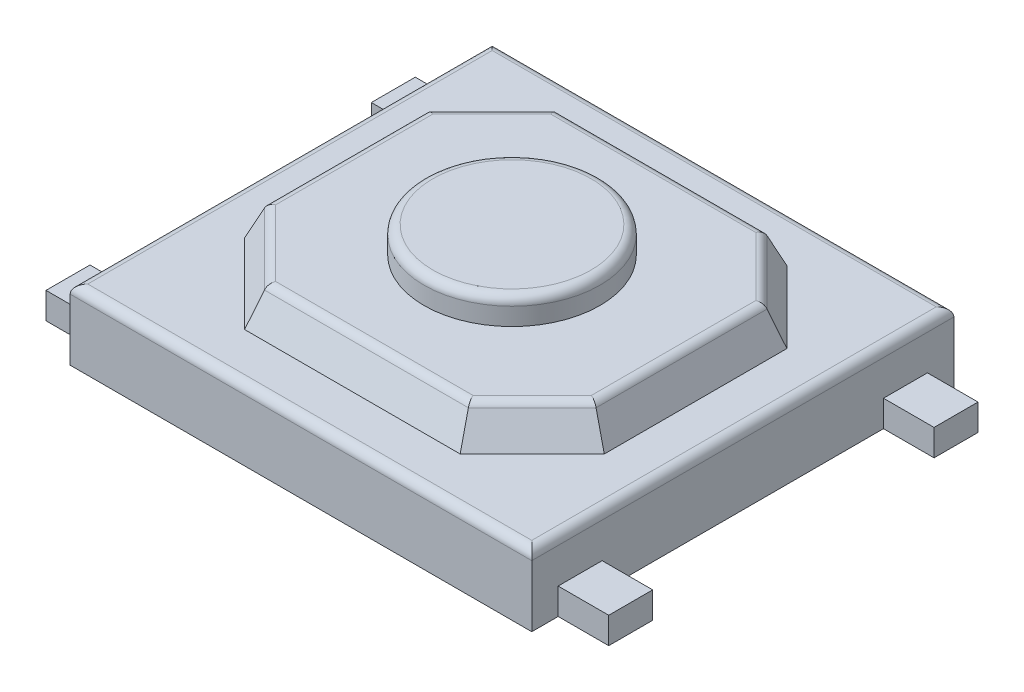
from build123d import *

# Parameters (mm, degrees)
SKETCH1_W               = 5.25
SKETCH1_H               = 4.8
BOSS_EXTRUDE1_DEPTH     = 0.8
BOSS_EXTRUDE2_DEPTH     = 0.4
SKETCH3_R               = 1
BOSS_EXTRUDE3_DEPTH     = 0.3
SKETCH4_W               = 0.5
SKETCH4_H               = 0.3
BOSS_EXTRUDE4_DEPTH     = 0.575
MIRROR2_COPY_1_SKETCH_W = 0.5
MIRROR2_COPY_1_SKETCH_H = 0.3
MIRROR2_COPY_1_DEPTH    = 0.575
DRAFT3_ANGLE            = 25
FILLET1_R               = 0.1
FILLET2_R               = 0.1


with BuildPart() as part:
    # Sketch1 → Boss-Extrude1 (new body)
    with BuildSketch(Plane(origin=(0, 0, 0), x_dir=(1, 0, 0), z_dir=(0, 1, 0))):
        Rectangle(SKETCH1_W, SKETCH1_H)
    extrude(amount=BOSS_EXTRUDE1_DEPTH)

    # Sketch2 → Boss-Extrude2 (add)
    with BuildSketch(Plane(origin=(0, 0.8, 0), x_dir=(1, 0, 0), z_dir=(0, 1, 0))):
        Polygon((-1.107585867, -1.67), (1.189705704, -1.67), (1.9, -0.959705704), (1.9, 0.962893219), (1.192893219, 1.67), (-1.192893219, 1.67), (-1.9, 0.962893219), (-1.9, -0.877585867), align=None)
    extrude(amount=BOSS_EXTRUDE2_DEPTH)

    # Sketch3 → Boss-Extrude3 (add)
    with BuildSketch(Plane(origin=(0, 1.2, 0), x_dir=(1, 0, 0), z_dir=(0, 1, 0))):
        with Locations(Location((0, 0, 0), (0, 0, 90))):
            Circle(SKETCH3_R)
    extrude(amount=BOSS_EXTRUDE3_DEPTH)

    # Sketch4 → Boss-Extrude4 (add)
    with BuildSketch(Plane(origin=(2.625, 0, 0), x_dir=(0, 0, -1), z_dir=(1, 0, 0))):
        with Locations((-1.85, 0.15)):
            Rectangle(SKETCH4_W, SKETCH4_H)
    boss_extrude4 = extrude(amount=BOSS_EXTRUDE4_DEPTH)

    # Mirror1: Boss-Extrude4 across plane
    add(boss_extrude4.mirror(Plane.XY))

    # Mirror2: Boss-Extrude4 across plane
    add(boss_extrude4.mirror(Plane(origin=(0, 0, 0), x_dir=(0, 0, 1), z_dir=(1, 0, 0))))

    # Mirror2 copy 1 sketch → Mirror2 copy 1 (add)
    with BuildSketch(Plane.ZY.offset(2.625)):
        with Locations((-1.85, 0.15)):
            Rectangle(MIRROR2_COPY_1_SKETCH_W, MIRROR2_COPY_1_SKETCH_H)
    extrude(amount=MIRROR2_COPY_1_DEPTH)

    # Draft3
    draft3_faces = [part.faces().sort_by_distance(p)[0] for p in [
        (1.544852852, 1, 1.314852852),
        (0.041059918, 1, 1.67),
        (-1.503792933, 1, 1.273792933),
        (-1.9, 1, -0.042653676),
        (-1.546446609, 1, -1.316446609),
        (0, 1, -1.67),
        (1.546446609, 1, -1.316446609),
        (1.9, 1, -0.001593757),
    ]]
    draft(draft3_faces, Plane(origin=(2.861299461, 1.2, -0.001593757), x_dir=(0, 0, 1), z_dir=(0, 1, 0)), DRAFT3_ANGLE)

    # Fillet1
    fillet1_edges = [part.edges().sort_by_distance(p)[0] for p in [
        (2.625, 0.8, 0),
        (0, 0.8, -2.4),
        (1.544852852, 1.2, 1.314852852),
        (1.9, 1.2, -0.001593757),
        (1.546446609, 1.2, -1.316446609),
        (0, 1.2, -1.67),
        (-1.546446609, 1.2, -1.316446609),
        (-1.9, 1.2, -0.042653676),
        (-1.503792933, 1.2, 1.273792933),
        (0.041059918, 1.2, 1.67),
        (-2.625, 0.8, 0),
        (0, 0.8, 2.4),
    ]]
    fillet(fillet1_edges, radius=FILLET1_R)

    # Fillet2
    fillet2_edges = [part.edges().sort_by_distance(p)[0] for p in [
        (0, 1.5, 1),
    ]]
    fillet(fillet2_edges, radius=FILLET2_R)


solid = part.part
